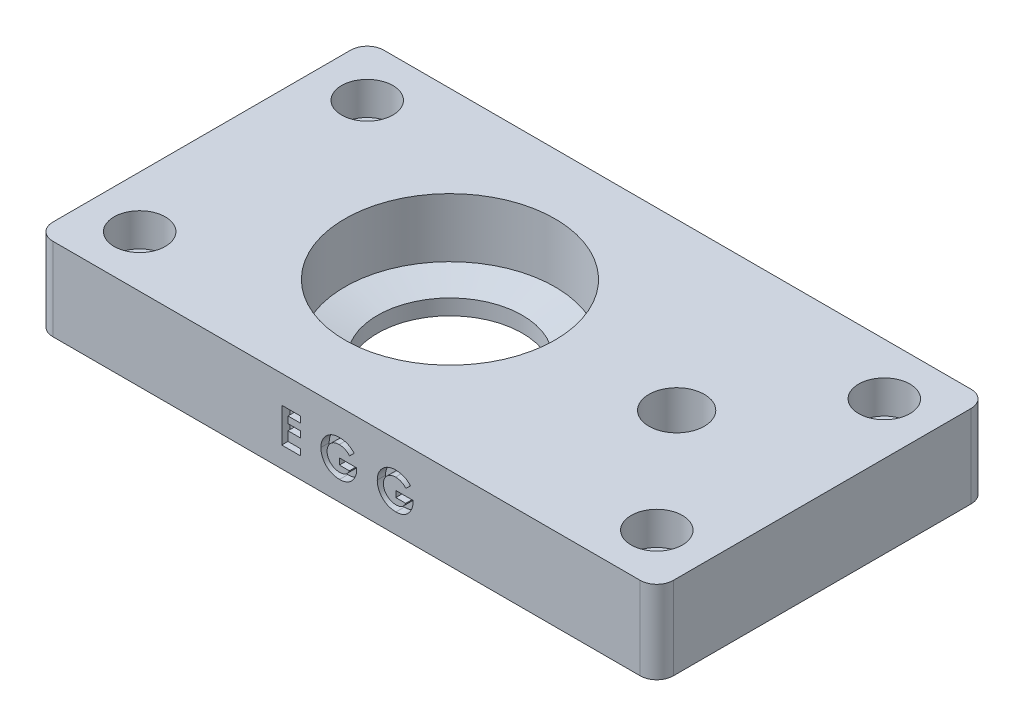
from build123d import *

# Parameters (mm, degrees)
SKETCH1_W           = 95.25
SKETCH1_H           = 50.8
BOSS_EXTRUDE1_DEPTH = 12.7
SKETCH4_R           = 2.54
CUT_EXTRUDE3_DEPTH  = 64.816710194
FILLET2_R           = 2.54
SKETCH8_R           = 4.25
CUT_EXTRUDE4_DEPTH  = 6.35
CUT_EXTRUDE5_DEPTH  = 1.27
SKETCH10_R          = 3.937
CUT_EXTRUDE6_DEPTH  = 5.08


with BuildPart() as part:
    # Sketch1 → Boss-Extrude1 (new body)
    with BuildSketch(Plane(origin=(0, 0, 0), x_dir=(1, 0, 0), z_dir=(0, 1, 0))):
        with Locations((9.525, 0)):
            Rectangle(SKETCH1_W, SKETCH1_H)
    extrude(amount=BOSS_EXTRUDE1_DEPTH)

    # Sketch4 → Cut-Extrude3 (cut, through all)
    with BuildSketch(Plane(origin=(0, 12.7, 0), x_dir=(1, 0, 0), z_dir=(0, 1, 0))):
        with Locations(Location((-30.1625, 17.4625, 0), (0, 0, 270))):
            Circle(SKETCH4_R)
        with Locations(Location((49.2125, 17.4625, 0), (0, 0, 270))):
            Circle(SKETCH4_R)
        with Locations(Location((49.2125, -17.4625, 0), (0, 0, 270))):
            Circle(SKETCH4_R)
        with Locations(Location((-30.1625, -17.4625, 0), (0, 0, 270))):
            Circle(SKETCH4_R)
    extrude(amount=-CUT_EXTRUDE3_DEPTH, mode=Mode.SUBTRACT)

    # Fillet2
    fillet2_edges = [part.edges().sort_by_distance(p)[0] for p in [
        (57.15, 6.35, 25.4),
        (-38.1, 6.35, 25.4),
        (-38.1, 6.35, -25.4),
        (57.15, 6.35, -25.4),
    ]]
    fillet(fillet2_edges, radius=FILLET2_R)

    # Sketch6 → Cut-Revolve1 (revolve, cut)
    with BuildSketch(Plane.XY, mode=Mode.PRIVATE) as cut_revolve1_sk:
        Polygon((0, 0), (0, 12.7), (-16.129, 12.7), (-16.129, 3.65125), (-11.1125, 2.38125), (-11.1125, 0), align=None)
    revolve(cut_revolve1_sk.sketch.rotate(Axis((0, 0, 0), (0, 1, 0)), 180), axis=Axis((0, 0, 0), (0, 1, 0)), mode=Mode.SUBTRACT)

    # Sketch8 → Cut-Extrude4 (cut)
    with BuildSketch(Plane(origin=(0, 12.7, 0), x_dir=(1, 0, 0), z_dir=(0, 1, 0))):
        with Locations(Location((34.798, 0, 0), (0, 0, 270))):
            Circle(SKETCH8_R)
    extrude(amount=-CUT_EXTRUDE4_DEPTH, mode=Mode.SUBTRACT)

    # Sketch9 → Cut-Extrude5 (cut)
    with BuildSketch(Plane.XY.offset(25.4)):
        Polygon((-0.41383547, 8.466666667), (2.435523504, 8.466666667), (2.435523504, 7.516880342), (0.535950855, 7.516880342), (0.535950855, 6.499252137), (2.435523504, 6.499252137), (2.435523504, 5.549465812), (0.535950855, 5.549465812), (0.535950855, 4.124786325), (2.435523504, 4.124786325), (2.435523504, 3.175), (-0.41383547, 3.175), align=None)
        with BuildLine():
            Line((10.711172877, 7.625003339), (9.992472957, 6.937044271))
            add(Edge.make_bspline(
                [(9.992472957, 6.937044271), (9.93557223, 6.994013175), (9.82392361, 7.105795569), (9.641336259, 7.251288038), (9.452231177, 7.374985399), (9.255985943, 7.476698021), (9.052327187, 7.555595175), (8.841656814, 7.612032833), (8.623632092, 7.645506964), (8.476039086, 7.650193228), (8.401368857, 7.652564103)],
                knots=[0, 0, 0, 0, 1.075575784, 2.110457258, 3.113929901, 4.09197124, 5.059417775, 6.02750972, 7.002078037, 8, 8, 8, 8], degree=3))
            add(Edge.make_bspline(
                [(8.401368857, 7.652564103), (8.336632051, 7.650902842), (8.209515658, 7.647640811), (8.02273036, 7.622869169), (7.844245567, 7.581489257), (7.673218042, 7.524164297), (7.510691968, 7.449566407), (7.355725638, 7.358846916), (7.209272716, 7.251311814), (7.072486413, 7.128999592), (6.947942044, 6.99545934), (6.839208234, 6.852524051), (6.746590388, 6.702857915), (6.670347011, 6.54569522), (6.612334092, 6.381277179), (6.57092046, 6.209723151), (6.544633101, 6.031531695), (6.54152935, 5.909967639), (6.539957265, 5.848394097)],
                knots=[0, 0, 0, 0, 1.075001177, 2.110859044, 3.123021556, 4.114053297, 5.101481495, 6.087880186, 7.091499647, 8.114004866, 9.131394192, 10.11971144, 11.092043119, 12.050101265, 13.015322563, 13.981809771, 14.977764287, 16, 16, 16, 16], degree=3))
            add(Edge.make_bspline(
                [(6.539957265, 5.848394097), (6.54142363, 5.784689413), (6.544312571, 5.659182463), (6.57206411, 5.47499562), (6.614820135, 5.297794604), (6.677403555, 5.128894206), (6.754424792, 4.965980726), (6.85210041, 4.812209954), (6.965999955, 4.665233641), (7.095919904, 4.527610729), (7.237239258, 4.400755525), (7.390292717, 4.291326961), (7.550423455, 4.196913731), (7.72021599, 4.122141505), (7.896723227, 4.062107598), (8.081735455, 4.019778542), (8.274836072, 3.993809814), (8.406586883, 3.990687267), (8.473450855, 3.989102564)],
                knots=[0, 0, 0, 0, 1.022067601, 2.013613092, 2.983553406, 3.943623673, 4.90013463, 5.87121881, 6.861774014, 7.881098904, 8.905697761, 9.905387765, 10.89678721, 11.884561068, 12.87834324, 13.885584958, 14.926927371, 16, 16, 16, 16], degree=3))
            add(Edge.make_bspline(
                [(8.473450855, 3.989102564), (8.516943392, 3.98949499), (8.602328921, 3.990265409), (8.727574942, 4.002771473), (8.847530546, 4.020650347), (8.96266029, 4.044319852), (9.071801671, 4.077816449), (9.176465828, 4.116986594), (9.276039519, 4.163215176), (9.369982868, 4.218097167), (9.459694023, 4.27961317), (9.544333271, 4.350000558), (9.625385284, 4.427672356), (9.701902978, 4.513577434), (9.772591271, 4.608483886), (9.839714836, 4.710647678), (9.902505119, 4.821082724), (9.93960624, 4.899066359), (9.958552017, 4.938888889)],
                knots=[0, 0, 0, 0, 1.109579412, 2.178351274, 3.208885622, 4.204702371, 5.174744997, 6.119429583, 7.05542196, 7.97267548, 8.893247984, 9.828544973, 10.778894627, 11.756245826, 12.760884819, 13.796418446, 14.874735809, 16, 16, 16, 16], degree=3))
            Line((9.958552017, 4.938888889), (8.439529915, 4.938888889))
            Line((8.439529915, 4.938888889), (8.439529915, 5.888675214))
            Line((8.439529915, 5.888675214), (11.077943042, 5.888675214))
            Line((11.077943042, 5.888675214), (11.085363248, 5.662888956))
            add(Edge.make_bspline(
                [(11.085363248, 5.662888956), (11.084409807, 5.604901316), (11.082504626, 5.48902952), (11.06509327, 5.316516156), (11.036251625, 5.146290823), (10.996822336, 4.978524493), (10.947407462, 4.812394211), (10.884388029, 4.649490812), (10.810592659, 4.488709541), (10.727910182, 4.330733593), (10.634998867, 4.179151376), (10.534966194, 4.035623026), (10.429238197, 3.90039696), (10.315515335, 3.775357217), (10.195568462, 3.659453406), (10.069161459, 3.553131425), (9.935847232, 3.45630131), (9.796332, 3.36814507), (9.649821088, 3.290881326), (9.497120014, 3.22367212), (9.338459336, 3.16659276), (9.173429428, 3.119800101), (9.002355028, 3.083695843), (8.825232472, 3.058939105), (8.641964482, 3.042116624), (8.517657681, 3.040260986), (8.454370326, 3.039316239)],
                knots=[0, 0, 0, 0, 1.006889344, 2.011981806, 3.007738725, 4.003571281, 5.003404394, 6.015442001, 7.03424805, 8.074616296, 9.110249922, 10.119753985, 11.111721717, 12.089233633, 13.052717867, 14.006597561, 14.955430184, 15.912305663, 16.870361111, 17.829300583, 18.807640451, 19.796414044, 20.806216501, 21.841577364, 22.90109906, 24, 24, 24, 24], degree=3))
            add(Edge.make_bspline(
                [(8.454370326, 3.039316239), (8.386847008, 3.040249194), (8.252995654, 3.042098589), (8.055078486, 3.059419429), (7.862903019, 3.088006358), (7.676421319, 3.127569691), (7.495200413, 3.176809418), (7.319551667, 3.238616924), (7.14983433, 3.312138907), (6.985540178, 3.395428476), (6.828769069, 3.489886103), (6.679872352, 3.593855461), (6.539662734, 3.708005338), (6.406704034, 3.830424841), (6.284102681, 3.964123052), (6.167289802, 4.104766164), (6.061924581, 4.257512405), (5.963476626, 4.417409697), (5.876014676, 4.584391035), (5.799527943, 4.755368013), (5.734300101, 4.929350673), (5.682866371, 5.107149136), (5.641106999, 5.287523644), (5.611227384, 5.471258603), (5.59435297, 5.658331013), (5.591571139, 5.784053363), (5.59017094, 5.847334068)],
                knots=[0, 0, 0, 0, 1.084149091, 2.14910686, 3.187506334, 4.202448172, 5.208724393, 6.201130722, 7.189831603, 8.176984443, 9.156919086, 10.126598231, 11.090766514, 12.05840148, 13.026036446, 14.001772938, 14.991905635, 16.003017641, 17.015720547, 18.016462227, 19.009322657, 19.99686681, 20.986544154, 21.980959929, 22.983742515, 24, 24, 24, 24], degree=3))
            add(Edge.make_bspline(
                [(5.59017094, 5.847334068), (5.592046105, 5.933662472), (5.595748999, 6.104135477), (5.630043422, 6.355243293), (5.683503317, 6.598165051), (5.76022365, 6.832016044), (5.858673953, 7.057118406), (5.97745959, 7.274000574), (6.119160841, 7.482432023), (6.228847343, 7.611480038), (6.284490184, 7.676944778)],
                knots=[0, 0, 0, 0, 1.034044851, 2.041932006, 3.031217818, 4.011390712, 4.986069675, 5.97149666, 6.970960976, 8, 8, 8, 8], degree=3))
            add(Edge.make_bspline(
                [(6.284490184, 7.676944778), (6.319038281, 7.714818115), (6.387615733, 7.789996117), (6.497236666, 7.894457482), (6.609637617, 7.992655029), (6.726375356, 8.082506542), (6.846836215, 8.165978913), (6.971366902, 8.241507386), (7.099314157, 8.311496827), (7.231675813, 8.372373311), (7.367758941, 8.426954157), (7.508166229, 8.473137227), (7.651846057, 8.51404445), (7.800070714, 8.545164355), (7.951342778, 8.571078637), (8.106736028, 8.588447745), (8.265827008, 8.601178066), (8.373428145, 8.601956549), (8.427869591, 8.602350427)],
                knots=[0, 0, 0, 0, 1.020590567, 2.025856924, 3.013483481, 3.991664875, 4.957826714, 5.930500614, 6.890802512, 7.860442893, 8.829981142, 9.809047939, 10.802672283, 11.803273349, 12.823572789, 13.857849586, 14.916166035, 16, 16, 16, 16], degree=3))
            add(Edge.make_bspline(
                [(8.427869591, 8.602350427), (8.484778578, 8.601472793), (8.598006566, 8.599726623), (8.766357833, 8.587644264), (8.932369745, 8.569004031), (9.095342714, 8.541042619), (9.255823677, 8.506560377), (9.412981946, 8.462380091), (9.567842784, 8.412183328), (9.668656603, 8.37216276), (9.718985377, 8.352183494)],
                knots=[0, 0, 0, 0, 1.03180557, 2.052914215, 3.058998889, 4.059601663, 5.049854447, 6.033765722, 7.018406786, 8, 8, 8, 8], degree=3))
            add(Edge.make_bspline(
                [(9.718985377, 8.352183494), (9.761330814, 8.333719055), (9.847460263, 8.296162899), (9.972767995, 8.227452149), (10.098381889, 8.151278397), (10.222946506, 8.064856553), (10.346272044, 7.968348267), (10.469646154, 7.86327787), (10.591809389, 7.748420181), (10.670869767, 7.666675065), (10.711172877, 7.625003339)],
                knots=[0, 0, 0, 0, 0.894392155, 1.819168899, 2.76525314, 3.739198753, 4.75366411, 5.797420238, 6.877176959, 8, 8, 8, 8], degree=3))
        make_face()
        with BuildLine():
            Line((19.36101262, 7.625003339), (18.6423127, 6.937044271))
            add(Edge.make_bspline(
                [(18.6423127, 6.937044271), (18.585411974, 6.994013175), (18.473763354, 7.105795569), (18.291176003, 7.251288038), (18.102070921, 7.374985399), (17.905825687, 7.476698021), (17.702166931, 7.555595175), (17.491496558, 7.612032833), (17.273471835, 7.645506964), (17.12587883, 7.650193228), (17.0512086, 7.652564103)],
                knots=[0, 0, 0, 0, 1.075575784, 2.110457258, 3.113929901, 4.09197124, 5.059417775, 6.02750972, 7.002078037, 8, 8, 8, 8], degree=3))
            add(Edge.make_bspline(
                [(17.0512086, 7.652564103), (16.986471794, 7.650902842), (16.859355401, 7.647640811), (16.672570104, 7.622869169), (16.494085311, 7.581489257), (16.323057786, 7.524164297), (16.160531712, 7.449566407), (16.005565381, 7.358846916), (15.859112459, 7.251311814), (15.722326157, 7.128999592), (15.597781788, 6.99545934), (15.489047978, 6.852524051), (15.396430131, 6.702857915), (15.320186755, 6.54569522), (15.262173836, 6.381277179), (15.220760203, 6.209723151), (15.194472845, 6.031531695), (15.191369093, 5.909967639), (15.189797009, 5.848394097)],
                knots=[0, 0, 0, 0, 1.075001177, 2.110859044, 3.123021556, 4.114053297, 5.101481495, 6.087880186, 7.091499647, 8.114004866, 9.131394192, 10.11971144, 11.092043119, 12.050101265, 13.015322563, 13.981809771, 14.977764287, 16, 16, 16, 16], degree=3))
            add(Edge.make_bspline(
                [(15.189797009, 5.848394097), (15.191263374, 5.784689413), (15.194152314, 5.659182463), (15.221903854, 5.47499562), (15.264659879, 5.297794604), (15.327243299, 5.128894206), (15.404264535, 4.965980726), (15.501940153, 4.812209954), (15.615839698, 4.665233641), (15.745759648, 4.527610729), (15.887079002, 4.400755525), (16.04013246, 4.291326961), (16.200263198, 4.196913731), (16.370055734, 4.122141505), (16.54656297, 4.062107598), (16.731575199, 4.019778542), (16.924675816, 3.993809814), (17.056426626, 3.990687267), (17.123290598, 3.989102564)],
                knots=[0, 0, 0, 0, 1.022067601, 2.013613092, 2.983553406, 3.943623673, 4.90013463, 5.87121881, 6.861774014, 7.881098904, 8.905697761, 9.905387765, 10.89678721, 11.884561068, 12.87834324, 13.885584958, 14.926927371, 16, 16, 16, 16], degree=3))
            add(Edge.make_bspline(
                [(17.123290598, 3.989102564), (17.166783136, 3.98949499), (17.252168665, 3.990265409), (17.377414685, 4.002771473), (17.49737029, 4.020650347), (17.612500033, 4.044319852), (17.721641415, 4.077816449), (17.826305571, 4.116986594), (17.925879263, 4.163215176), (18.019822612, 4.218097167), (18.109533767, 4.27961317), (18.194173015, 4.350000558), (18.275225027, 4.427672356), (18.351742722, 4.513577434), (18.422431015, 4.608483886), (18.489554579, 4.710647678), (18.552344862, 4.821082724), (18.589445984, 4.899066359), (18.60839176, 4.938888889)],
                knots=[0, 0, 0, 0, 1.109579412, 2.178351274, 3.208885622, 4.204702371, 5.174744997, 6.119429583, 7.05542196, 7.97267548, 8.893247984, 9.828544973, 10.778894627, 11.756245826, 12.760884819, 13.796418446, 14.874735809, 16, 16, 16, 16], degree=3))
            Line((18.60839176, 4.938888889), (17.089369658, 4.938888889))
            Line((17.089369658, 4.938888889), (17.089369658, 5.888675214))
            Line((17.089369658, 5.888675214), (19.727782786, 5.888675214))
            Line((19.727782786, 5.888675214), (19.735202991, 5.662888956))
            add(Edge.make_bspline(
                [(19.735202991, 5.662888956), (19.73424955, 5.604901316), (19.732344369, 5.48902952), (19.714933014, 5.316516156), (19.686091369, 5.146290823), (19.64666208, 4.978524493), (19.597247206, 4.812394211), (19.534227773, 4.649490812), (19.460432402, 4.488709541), (19.377749925, 4.330733593), (19.28483861, 4.179151376), (19.184805937, 4.035623026), (19.07907794, 3.90039696), (18.965355079, 3.775357217), (18.845408205, 3.659453406), (18.719001203, 3.553131425), (18.585686976, 3.45630131), (18.446171743, 3.36814507), (18.299660832, 3.290881326), (18.146959758, 3.22367212), (17.988299079, 3.16659276), (17.823269171, 3.119800101), (17.652194772, 3.083695843), (17.475072216, 3.058939105), (17.291804226, 3.042116624), (17.167497425, 3.040260986), (17.104210069, 3.039316239)],
                knots=[0, 0, 0, 0, 1.006889344, 2.011981806, 3.007738725, 4.003571281, 5.003404394, 6.015442001, 7.03424805, 8.074616296, 9.110249922, 10.119753985, 11.111721717, 12.089233633, 13.052717867, 14.006597561, 14.955430184, 15.912305663, 16.870361111, 17.829300583, 18.807640451, 19.796414044, 20.806216501, 21.841577364, 22.90109906, 24, 24, 24, 24], degree=3))
            add(Edge.make_bspline(
                [(17.104210069, 3.039316239), (17.036686752, 3.040249194), (16.902835397, 3.042098589), (16.70491823, 3.059419429), (16.512742763, 3.088006358), (16.326261063, 3.127569691), (16.145040157, 3.176809418), (15.969391411, 3.238616924), (15.799674074, 3.312138907), (15.635379921, 3.395428476), (15.478608812, 3.489886103), (15.329712095, 3.593855461), (15.189502478, 3.708005338), (15.056543778, 3.830424841), (14.933942425, 3.964123052), (14.817129546, 4.104766164), (14.711764325, 4.257512405), (14.613316369, 4.417409697), (14.525854419, 4.584391035), (14.449367687, 4.755368013), (14.384139844, 4.929350673), (14.332706114, 5.107149136), (14.290946742, 5.287523644), (14.261067128, 5.471258603), (14.244192714, 5.658331013), (14.241410882, 5.784053363), (14.240010684, 5.847334068)],
                knots=[0, 0, 0, 0, 1.084149091, 2.14910686, 3.187506334, 4.202448172, 5.208724393, 6.201130722, 7.189831603, 8.176984443, 9.156919086, 10.126598231, 11.090766514, 12.05840148, 13.026036446, 14.001772938, 14.991905635, 16.003017641, 17.015720547, 18.016462227, 19.009322657, 19.99686681, 20.986544154, 21.980959929, 22.983742515, 24, 24, 24, 24], degree=3))
            add(Edge.make_bspline(
                [(14.240010684, 5.847334068), (14.241885849, 5.933662472), (14.245588743, 6.104135477), (14.279883166, 6.355243293), (14.333343061, 6.598165051), (14.410063393, 6.832016044), (14.508513697, 7.057118406), (14.627299333, 7.274000574), (14.769000585, 7.482432023), (14.878687086, 7.611480038), (14.934329928, 7.676944778)],
                knots=[0, 0, 0, 0, 1.034044851, 2.041932006, 3.031217818, 4.011390712, 4.986069675, 5.97149666, 6.970960976, 8, 8, 8, 8], degree=3))
            add(Edge.make_bspline(
                [(14.934329928, 7.676944778), (14.968878025, 7.714818115), (15.037455477, 7.789996117), (15.14707641, 7.894457482), (15.25947736, 7.992655029), (15.3762151, 8.082506542), (15.496675959, 8.165978913), (15.621206645, 8.241507386), (15.7491539, 8.311496827), (15.881515557, 8.372373311), (16.017598684, 8.426954157), (16.158005973, 8.473137227), (16.301685801, 8.51404445), (16.449910458, 8.545164355), (16.601182522, 8.571078637), (16.756575771, 8.588447745), (16.915666751, 8.601178066), (17.023267888, 8.601956549), (17.077709335, 8.602350427)],
                knots=[0, 0, 0, 0, 1.020590567, 2.025856924, 3.013483481, 3.991664875, 4.957826714, 5.930500614, 6.890802512, 7.860442893, 8.829981142, 9.809047939, 10.802672283, 11.803273349, 12.823572789, 13.857849586, 14.916166035, 16, 16, 16, 16], degree=3))
            add(Edge.make_bspline(
                [(17.077709335, 8.602350427), (17.134618322, 8.601472793), (17.247846309, 8.599726623), (17.416197576, 8.587644264), (17.582209489, 8.569004031), (17.745182458, 8.541042619), (17.90566342, 8.506560377), (18.062821689, 8.462380091), (18.217682527, 8.412183328), (18.318496346, 8.37216276), (18.36882512, 8.352183494)],
                knots=[0, 0, 0, 0, 1.03180557, 2.052914215, 3.058998889, 4.059601663, 5.049854447, 6.033765722, 7.018406786, 8, 8, 8, 8], degree=3))
            add(Edge.make_bspline(
                [(18.36882512, 8.352183494), (18.411170558, 8.333719055), (18.497300007, 8.296162899), (18.622607739, 8.227452149), (18.748221632, 8.151278397), (18.872786249, 8.064856553), (18.996111788, 7.968348267), (19.119485898, 7.86327787), (19.241649132, 7.748420181), (19.32070951, 7.666675065), (19.36101262, 7.625003339)],
                knots=[0, 0, 0, 0, 0.894392155, 1.819168899, 2.76525314, 3.739198753, 4.75366411, 5.797420238, 6.877176959, 8, 8, 8, 8], degree=3))
        make_face()
    extrude(amount=-CUT_EXTRUDE5_DEPTH, mode=Mode.SUBTRACT)

    # Sketch10 → Cut-Extrude6 (cut)
    with BuildSketch(Plane(origin=(0, 12.7, 0), x_dir=(1, 0, 0), z_dir=(0, 1, 0))):
        with Locations(Location((-30.1625, 17.4625, 0), (0, 0, 270))):
            Circle(SKETCH10_R)
        with Locations(Location((-30.1625, -17.4625, 0), (0, 0, 270))):
            Circle(SKETCH10_R)
        with Locations(Location((49.2125, 17.4625, 0), (0, 0, 270))):
            Circle(SKETCH10_R)
        with Locations(Location((49.2125, -17.4625, 0), (0, 0, 270))):
            Circle(SKETCH10_R)
    extrude(amount=-CUT_EXTRUDE6_DEPTH, mode=Mode.SUBTRACT)


solid = part.part
